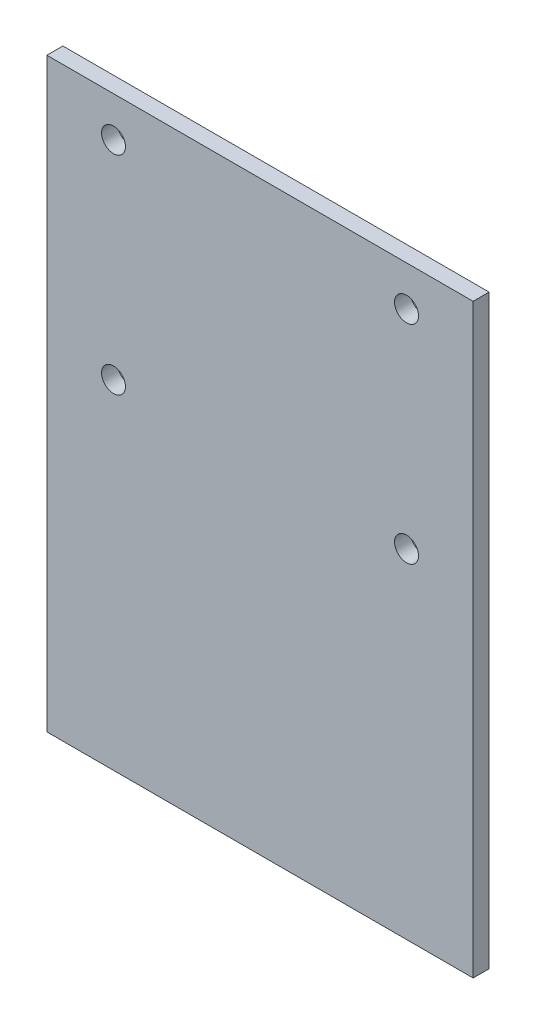
from build123d import *

# Parameters (mm, degrees)
SKETCH1_W           = 80
SKETCH1_H           = 110
BOSS_EXTRUDE1_DEPTH = 3
D_GAGEMENT_M41_D    = 4.5


with BuildPart() as part:
    # Sketch1 → Boss-Extrude1 (new body)
    with BuildSketch(Plane.XY):
        Rectangle(SKETCH1_W, SKETCH1_H)
    extrude(amount=BOSS_EXTRUDE1_DEPTH)

    # Dégagement M41 (through all)
    with Locations(Plane.XY.offset(3)):
        with Locations((27.50000229, 47.500001598), (27.50000229, 8.500001598), (-27.49999771, 8.500001598), (-27.49999771, 47.500001598)):
            Hole(D_GAGEMENT_M41_D / 2)


solid = part.part
